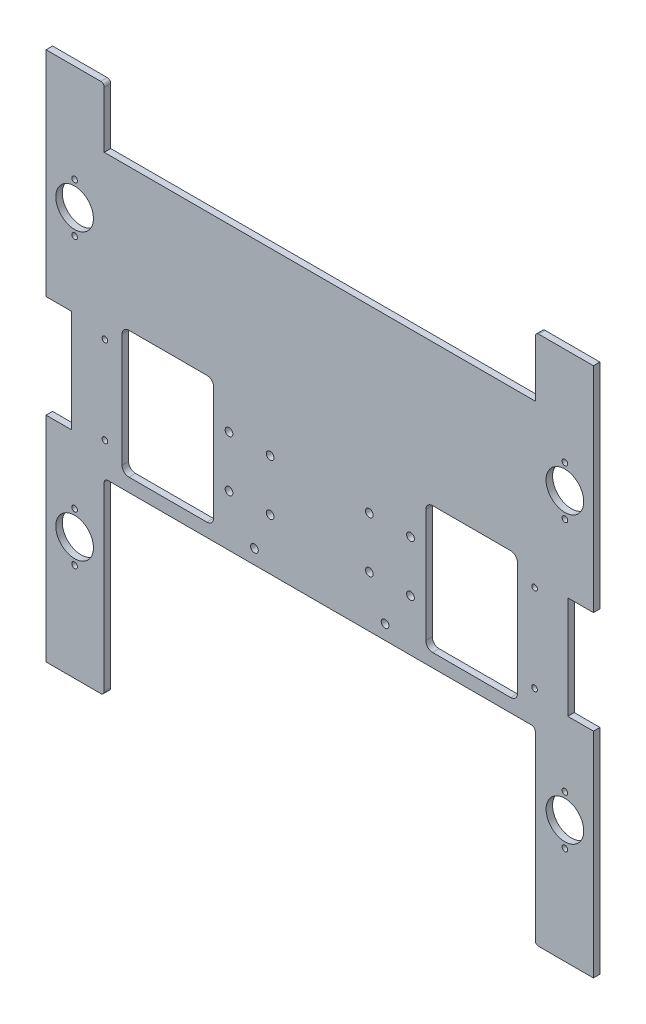
from build123d import *

# Parameters (mm, degrees)
SKETCH2_R           = 1.65
SKETCH2_R_2         = 11
SKETCH2_R_3         = 2.25
BOSS_EXTRUDE1_DEPTH = 3.8


with BuildPart() as part:
    # Sketch2 → Boss-Extrude1 (new body)
    with BuildSketch(Plane.XY):
        with BuildLine():
            Line((-160, 180), (-128, 180))
            ThreePointArc((-128, 180), (-126.585786438, 179.414213562), (-126, 178))
            Line((-126, 178), (-126, 145.072545974))
            Line((-126, 145.072545974), (126, 145.072545974))
            Line((126, 145.072545974), (126, 178))
            ThreePointArc((126, 178), (126.585786438, 179.414213562), (128, 180))
            Line((128, 180), (160, 180))
            Line((160, 180), (160, 55))
            Line((160, 55), (145, 55))
            Line((145, 55), (145, -5))
            Line((145, -5), (160, -5))
            Line((160, -5), (160, -130))
            Line((160, -130), (128, -130))
            ThreePointArc((128, -130), (126.585786438, -129.414213562), (126, -128))
            Line((126, -128), (126, -22))
            ThreePointArc((126, -22), (125.414213562, -20.585786438), (124, -20))
            Line((124, -20), (-124, -20))
            ThreePointArc((-124, -20), (-125.414213562, -20.585786438), (-126, -22))
            Line((-126, -22), (-126, -128))
            ThreePointArc((-126, -128), (-126.585786438, -129.414213562), (-128, -130))
            Line((-128, -130), (-160, -130))
            Line((-160, -130), (-160, -5))
            Line((-160, -5), (-145, -5))
            Line((-145, -5), (-145, 55))
            Line((-145, 55), (-160, 55))
            Line((-160, 55), (-160, 180))
        make_face()
        with Locations(Location((-143.329179578, 122.685954214, 0), (0, 0, 180))):
            Circle(SKETCH2_R, mode=Mode.SUBTRACT)
        with Locations(Location((-143.329179578, 94.016348561, 0), (0, 0, 180))):
            Circle(SKETCH2_R, mode=Mode.SUBTRACT)
        with Locations(Location((143.329179578, 122.685954214, 0), (0, 0, 180))):
            Circle(SKETCH2_R, mode=Mode.SUBTRACT)
        with Locations(Location((143.329179578, 94.016348561, 0), (0, 0, 180))):
            Circle(SKETCH2_R, mode=Mode.SUBTRACT)
        with Locations(Location((143.329179578, 108.351151387, 0), (0, 0, 180))):
            Circle(SKETCH2_R_2, mode=Mode.SUBTRACT)
        with Locations(Location((-143.329179578, 108.351151387, 0), (0, 0, 180))):
            Circle(SKETCH2_R_2, mode=Mode.SUBTRACT)
        with Locations(Location((125.59774802, -0.5, 0), (0, 0, 180))):
            Circle(SKETCH2_R, mode=Mode.SUBTRACT)
        with Locations(Location((125.59774802, 50.5, 0), (0, 0, 180))):
            Circle(SKETCH2_R, mode=Mode.SUBTRACT)
        with Locations(Location((-125.59774802, -0.5, 0), (0, 0, 180))):
            Circle(SKETCH2_R, mode=Mode.SUBTRACT)
        with Locations(Location((-125.59774802, 50.5, 0), (0, 0, 180))):
            Circle(SKETCH2_R, mode=Mode.SUBTRACT)
        with Locations(Location((-29, 10.055, 0), (0, 0, 180))):
            Circle(SKETCH2_R_3, mode=Mode.SUBTRACT)
        with Locations(Location((-29, 39.945, 0), (0, 0, 180))):
            Circle(SKETCH2_R_3, mode=Mode.SUBTRACT)
        with Locations(Location((-53.06, 39.945, 0), (0, 0, 180))):
            Circle(SKETCH2_R_3, mode=Mode.SUBTRACT)
        with Locations(Location((-53.06, 10.055, 0), (0, 0, 180))):
            Circle(SKETCH2_R_3, mode=Mode.SUBTRACT)
        with Locations(Location((53.06, 10.055, 0), (0, 0, 180))):
            Circle(SKETCH2_R_3, mode=Mode.SUBTRACT)
        with Locations(Location((29, 10.055, 0), (0, 0, 180))):
            Circle(SKETCH2_R_3, mode=Mode.SUBTRACT)
        with Locations(Location((29, 39.945, 0), (0, 0, 180))):
            Circle(SKETCH2_R_3, mode=Mode.SUBTRACT)
        with Locations(Location((53.06, 39.945, 0), (0, 0, 180))):
            Circle(SKETCH2_R_3, mode=Mode.SUBTRACT)
        with Locations(Location((143.329179578, -72.685954214, 0), (0, 0, 180))):
            Circle(SKETCH2_R, mode=Mode.SUBTRACT)
        with Locations(Location((143.329179578, -44.016348561, 0), (0, 0, 180))):
            Circle(SKETCH2_R, mode=Mode.SUBTRACT)
        with Locations(Location((143.329179578, -58.351151387, 0), (0, 0, 180))):
            Circle(SKETCH2_R_2, mode=Mode.SUBTRACT)
        with Locations(Location((-143.329179578, -58.351151387, 0), (0, 0, 180))):
            Circle(SKETCH2_R_2, mode=Mode.SUBTRACT)
        with Locations(Location((-143.329179578, -44.016348561, 0), (0, 0, 180))):
            Circle(SKETCH2_R, mode=Mode.SUBTRACT)
        with Locations(Location((-143.329179578, -72.685954214, 0), (0, 0, 180))):
            Circle(SKETCH2_R, mode=Mode.SUBTRACT)
        with Locations(Location((38.179918963, -11.563765186, 0), (0, 0, 180))):
            Circle(SKETCH2_R_3, mode=Mode.SUBTRACT)
        with Locations(Location((-38.179918963, -11.563765186, 0), (0, 0, 180))):
            Circle(SKETCH2_R_3, mode=Mode.SUBTRACT)
        with BuildLine():
            Line((-66, 62.171403079), (-111.59774802, 62.171403079))
            ThreePointArc((-111.59774802, 62.171403079), (-114.426175145, 60.999830204), (-115.59774802, 58.171403079))
            Line((-115.59774802, 58.171403079), (-115.59774802, -8.171403079))
            ThreePointArc((-115.59774802, -8.171403079), (-114.426175145, -10.999830204), (-111.59774802, -12.171403079))
            Line((-111.59774802, -12.171403079), (-66, -12.171403079))
            ThreePointArc((-66, -12.171403079), (-63.171572875, -10.999830204), (-62, -8.171403079))
            Line((-62, -8.171403079), (-62, 58.171403079))
            ThreePointArc((-62, 58.171403079), (-63.171572875, 60.999830204), (-66, 62.171403079))
        make_face(mode=Mode.SUBTRACT)
        with BuildLine():
            Line((66, 62.171403079), (111.59774802, 62.171403079))
            ThreePointArc((111.59774802, 62.171403079), (114.426175145, 60.999830204), (115.59774802, 58.171403079))
            Line((115.59774802, 58.171403079), (115.59774802, -8.171403079))
            ThreePointArc((115.59774802, -8.171403079), (114.426175145, -10.999830204), (111.59774802, -12.171403079))
            Line((111.59774802, -12.171403079), (66, -12.171403079))
            ThreePointArc((66, -12.171403079), (63.171572875, -10.999830204), (62, -8.171403079))
            Line((62, -8.171403079), (62, 58.171403079))
            ThreePointArc((62, 58.171403079), (63.171572875, 60.999830204), (66, 62.171403079))
        make_face(mode=Mode.SUBTRACT)
    extrude(amount=BOSS_EXTRUDE1_DEPTH)


solid = part.part
